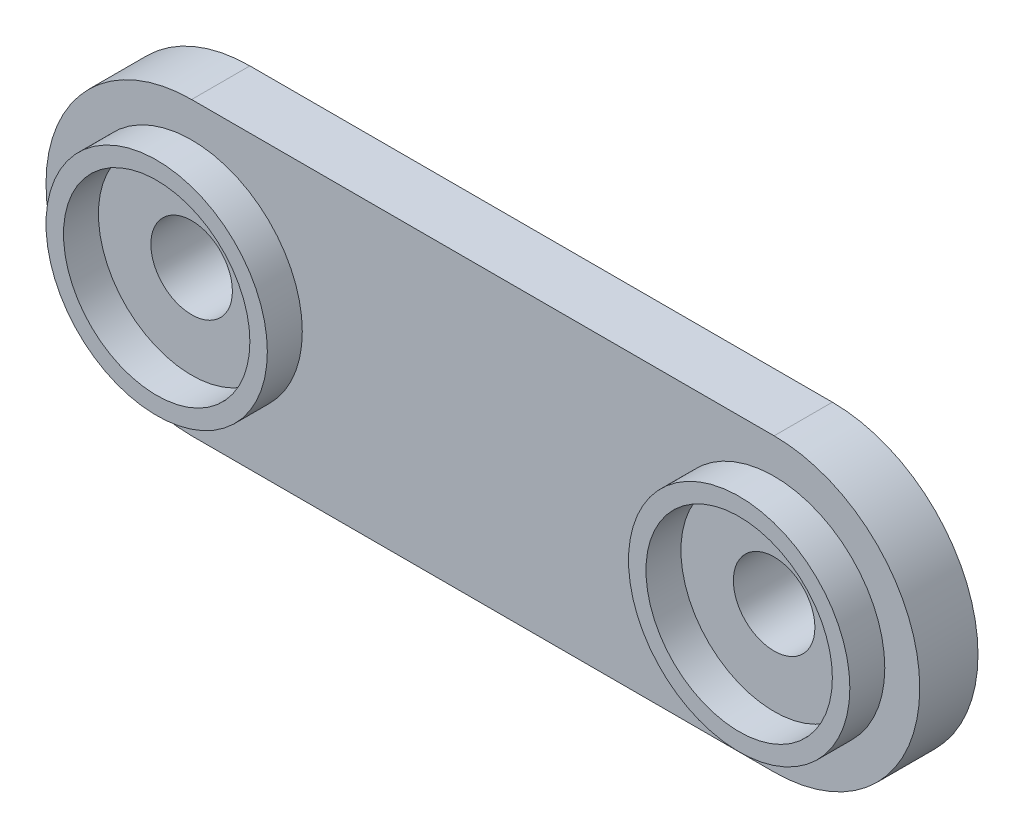
from build123d import *

# Parameters (mm, degrees)
SKETCH1_R           = 12.5
SKETCH1_W           = 50
SKETCH1_H           = 25
BOSS_EXTRUDE2_DEPTH = 5
CUT_EXTRUDE3_REACH  = 69.5
SKETCH3_R           = 3.5
SKETCH3_3_R         = 9.5
SKETCH3_3_R_2       = 8
BOSS_EXTRUDE3_DEPTH = 3


with BuildPart() as part:
    # Sketch1 → Boss-Extrude2 (new body)
    with BuildSketch(Plane.XY):
        with Locations((0, 12.5)):
            Circle(SKETCH1_R)
        with Locations((50, 12.5)):
            Circle(SKETCH1_R)
        with Locations((25, 12.5)):
            Rectangle(SKETCH1_W, SKETCH1_H)
    extrude(amount=BOSS_EXTRUDE2_DEPTH)

    # Sketch3 → Cut-Extrude3 (cut, up to next)
    with BuildSketch(Plane.XY.offset(5), mode=Mode.PRIVATE) as cut_extrude3_sk1:
        with Locations((0, 12.5)):
            Circle(SKETCH3_R)
    cut_extrude3_tool1 = extrude(cut_extrude3_sk1.sketch, amount=-CUT_EXTRUDE3_REACH, mode=Mode.PRIVATE) & part.part
    # Sketch3 → Cut-Extrude3 (cut, up to next)
    with BuildSketch(Plane.XY.offset(5), mode=Mode.PRIVATE) as cut_extrude3_sk2:
        with Locations((50, 12.5)):
            Circle(SKETCH3_R)
    cut_extrude3_tool2 = extrude(cut_extrude3_sk2.sketch, amount=-CUT_EXTRUDE3_REACH, mode=Mode.PRIVATE) & part.part
    add(cut_extrude3_tool1.solids().sort_by_distance((0, 12.5, 5))[0], mode=Mode.SUBTRACT)
    add(cut_extrude3_tool2.solids().sort_by_distance((50, 12.5, 5))[0], mode=Mode.SUBTRACT)

    # Sketch3<3> → Boss-Extrude3 (add)
    # profile 1 of 2: a face of its own
    with BuildSketch(Plane.XY.offset(5)):
        with Locations((0, 12.5)):
            Circle(SKETCH3_3_R)
        with Locations((0, 12.5)):
            Circle(SKETCH3_3_R_2, mode=Mode.SUBTRACT)
    # profile 2 of 2: a face of its own
    with BuildSketch(Plane.XY.offset(5)):
        with Locations((50, 12.5)):
            Circle(SKETCH3_3_R)
        with Locations((50, 12.5)):
            Circle(SKETCH3_3_R_2, mode=Mode.SUBTRACT)
    extrude(amount=BOSS_EXTRUDE3_DEPTH)


solid = part.part
